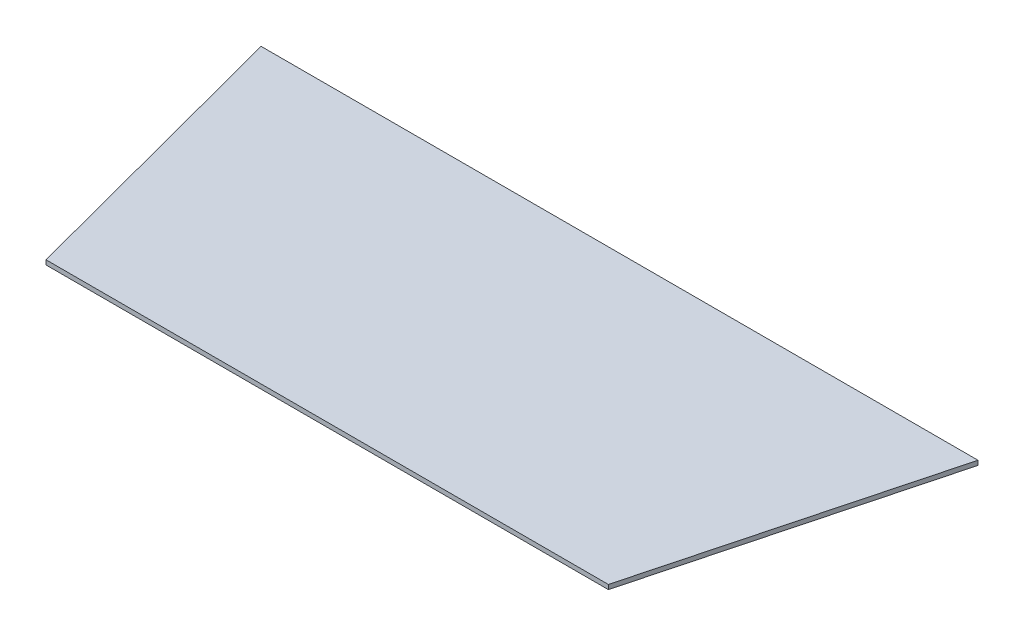
from build123d import *

# Parameters (mm, degrees)
EXTRUDE1_DEPTH = 10


with BuildPart() as part:
    # Sketch1 → Extrude1 (new body)
    with BuildSketch(Plane(origin=(0, 0, 0), x_dir=(1, 0, 0), z_dir=(0, 1, 0))):
        Polygon((66.080257096, 649.896265253), (237.790257096, 0), (1487.790257096, 0), (1659.500257096, 649.896265253), align=None)
    extrude(amount=EXTRUDE1_DEPTH)


solid = part.part
